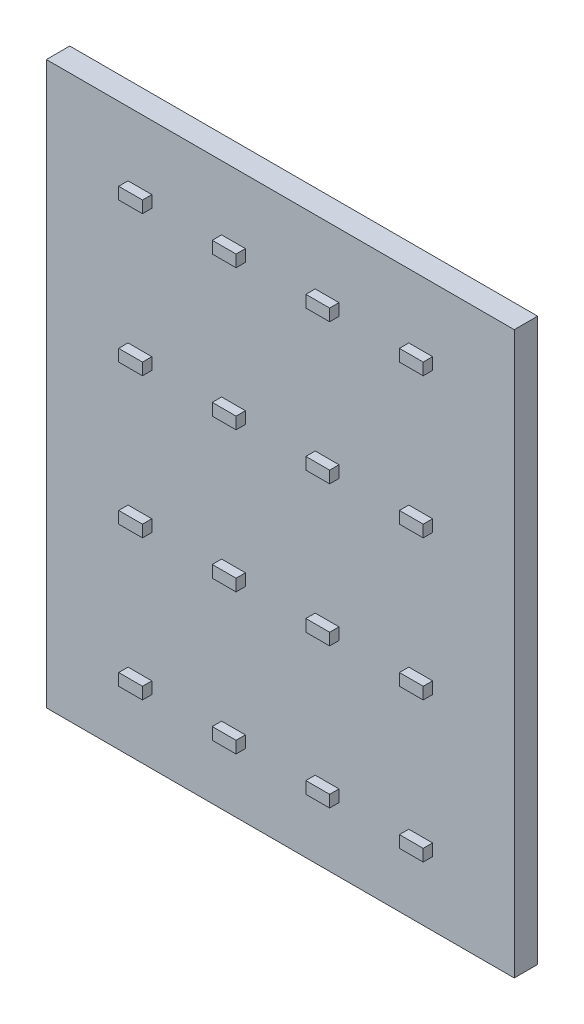
from build123d import *

# Parameters (mm, degrees)
SKETCH_1_W      = 100
SKETCH_1_H      = 120
EXTRUDE_1_DEPTH = 5
SKETCH_2_W      = 5.086017552
SKETCH_2_H      = 2.543008776
EXTRUDE_2_DEPTH = 2


with BuildPart() as part:
    # 草图1 → 凸台-拉伸1 (new body)
    with BuildSketch(Plane.XY):
        Rectangle(SKETCH_1_W, SKETCH_1_H)
    extrude(amount=EXTRUDE_1_DEPTH)

    # 草图2 → 凸台-拉伸2 (add)
    with BuildSketch(Plane.XY.offset(5)):
        with Locations((-10, 45)):
            Rectangle(SKETCH_2_W, SKETCH_2_H)
        with Locations((-30, 45)):
            Rectangle(SKETCH_2_W, SKETCH_2_H)
        with Locations((10, 45)):
            Rectangle(SKETCH_2_W, SKETCH_2_H)
        with Locations((30, 45)):
            Rectangle(SKETCH_2_W, SKETCH_2_H)
        with Locations((-30, 15)):
            Rectangle(SKETCH_2_W, SKETCH_2_H)
        with Locations((-10, 15)):
            Rectangle(SKETCH_2_W, SKETCH_2_H)
        with Locations((10, 15)):
            Rectangle(SKETCH_2_W, SKETCH_2_H)
        with Locations((30, 15)):
            Rectangle(SKETCH_2_W, SKETCH_2_H)
        with Locations((-30, -15)):
            Rectangle(SKETCH_2_W, SKETCH_2_H)
        with Locations((-10, -15)):
            Rectangle(SKETCH_2_W, SKETCH_2_H)
        with Locations((10, -15)):
            Rectangle(SKETCH_2_W, SKETCH_2_H)
        with Locations((30, -15)):
            Rectangle(SKETCH_2_W, SKETCH_2_H)
        with Locations((-30, -45)):
            Rectangle(SKETCH_2_W, SKETCH_2_H)
        with Locations((-10, -45)):
            Rectangle(SKETCH_2_W, SKETCH_2_H)
        with Locations((10, -45)):
            Rectangle(SKETCH_2_W, SKETCH_2_H)
        with Locations((30, -45)):
            Rectangle(SKETCH_2_W, SKETCH_2_H)
    extrude(amount=EXTRUDE_2_DEPTH)


solid = part.part
